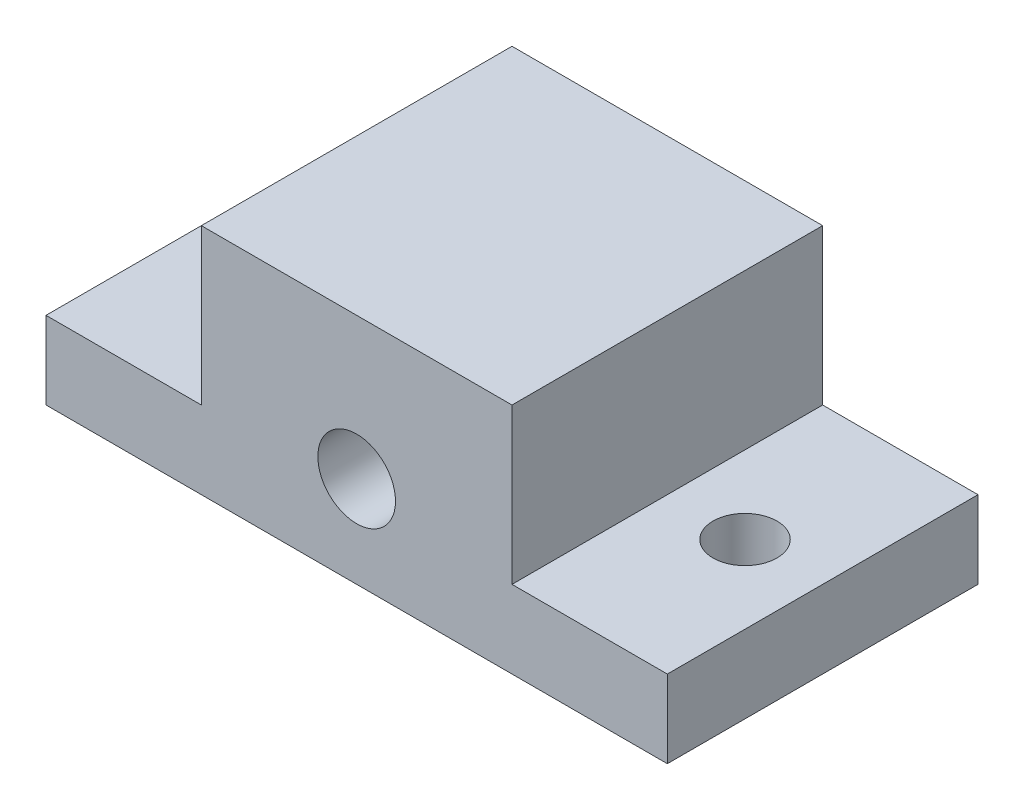
from build123d import *

# Parameters (mm, degrees)
SKETCH1_W           = 25.4
SKETCH1_H           = 9.525
BOSS_EXTRUDE1_DEPTH = 12.7
SKETCH2_R           = 1.5875
SKETCH2_W           = 6.35
SKETCH2_H           = 6.35
CUT_EXTRUDE1_DEPTH  = 19.581211108
SKETCH4_R           = 1.308790008
CUT_EXTRUDE2_DEPTH  = 20.05


with BuildPart() as part:
    # Sketch1 → Boss-Extrude1 (new body)
    with BuildSketch(Plane.XY):
        Rectangle(SKETCH1_W, SKETCH1_H)
    extrude(amount=BOSS_EXTRUDE1_DEPTH)

    # Sketch2 → Cut-Extrude1 (cut, through all)
    with BuildSketch(Plane.XY.offset(12.7)):
        with Locations((0, -1.0287)):
            Circle(SKETCH2_R)
        with Locations((-9.525, 1.5875)):
            Rectangle(SKETCH2_W, SKETCH2_H)
        with Locations((9.525, 1.5875)):
            Rectangle(SKETCH2_W, SKETCH2_H)
    extrude(amount=-CUT_EXTRUDE1_DEPTH, mode=Mode.SUBTRACT)

    # Sketch4 → Cut-Extrude2 (cut, through all)
    with BuildSketch(Plane(origin=(0, -1.5875, 0), x_dir=(1, 0, 0), z_dir=(0, 1, 0))):
        with Locations(Location((9.525, -6.35, 0), (0, 0, 180))):
            Circle(SKETCH4_R)
        with Locations(Location((-9.525, -6.35, 0), (0, 0, 180))):
            Circle(SKETCH4_R)
    extrude(amount=-CUT_EXTRUDE2_DEPTH, mode=Mode.SUBTRACT)


solid = part.part
